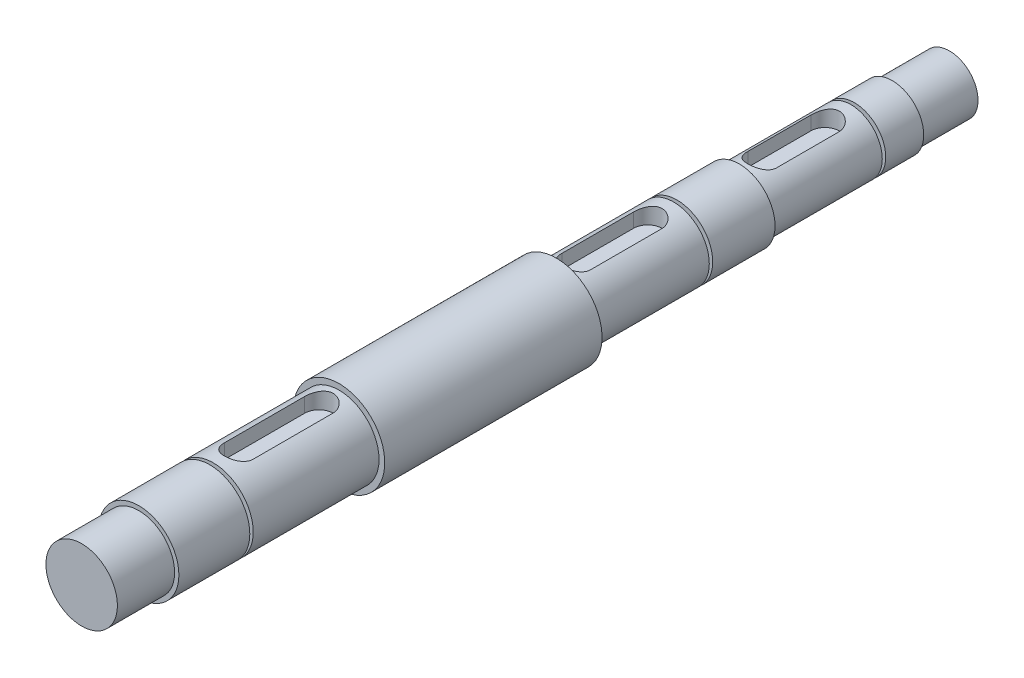
from build123d import *

# Parameters (mm, degrees)
SKETCH2_R           = 12.5
BOSS_EXTRUDE1_DEPTH = 20
SKETCH3_R           = 14
BOSS_EXTRUDE2_DEPTH = 70
SKETCH4_R           = 16
BOSS_EXTRUDE3_DEPTH = 76
BOSS_EXTRUDE4_START = 64
SKETCH5_R           = 12.5
BOSS_EXTRUDE4_DEPTH = 64
SKETCH6_R           = 11
BOSS_EXTRUDE5_DEPTH = 53.5
SKETCH7_R           = 10
BOSS_EXTRUDE6_DEPTH = 20
CUT_EXTRUDE1_DEPTH  = 6
CUT_EXTRUDE2_DEPTH  = 6
CUT_EXTRUDE3_DEPTH  = 6
SKETCH12_W          = 1.2
SKETCH12_H          = 1.8


with BuildPart() as part:
    # Sketch2 → Boss-Extrude1 (new body)
    with BuildSketch(Plane.XY):
        Circle(SKETCH2_R)
    extrude(amount=BOSS_EXTRUDE1_DEPTH)

    # Sketch3 → Boss-Extrude2 (add)
    with BuildSketch(Plane(origin=(0, 0, 0), x_dir=(-1, 0, 0), z_dir=(0, 0, -1))):
        Circle(SKETCH3_R)
    extrude(amount=BOSS_EXTRUDE2_DEPTH)

    # Sketch4 → Boss-Extrude3 (add)
    with BuildSketch(Plane(origin=(0, 0, -70), x_dir=(-1, 0, 0), z_dir=(0, 0, -1))):
        Circle(SKETCH4_R)
    extrude(amount=BOSS_EXTRUDE3_DEPTH)

    # Sketch5 → Boss-Extrude4 (add)
    with BuildSketch(Plane(origin=(0, 0, -146), x_dir=(-1, 0, 0), z_dir=(0, 0, -1)).offset(BOSS_EXTRUDE4_START)):
        with Locations(Location((0, 0, 0), (0, 0, 180))):
            Circle(SKETCH5_R)
    extrude(amount=-BOSS_EXTRUDE4_DEPTH)

    # Sketch6 → Boss-Extrude5 (add)
    with BuildSketch(Plane(origin=(0, 0, -210), x_dir=(-1, 0, 0), z_dir=(0, 0, -1))):
        Circle(SKETCH6_R)
    extrude(amount=BOSS_EXTRUDE5_DEPTH)

    # Sketch7 → Boss-Extrude6 (add)
    with BuildSketch(Plane(origin=(0, 0, -263.5), x_dir=(-1, 0, 0), z_dir=(0, 0, -1))):
        Circle(SKETCH7_R)
    extrude(amount=BOSS_EXTRUDE6_DEPTH)

    # Sketch8 → Cut-Extrude1 (cut)
    with BuildSketch(Plane(origin=(0, 14, 0), x_dir=(1, 0, 0), z_dir=(0, 1, 0))):
        with BuildLine():
            Line((5, 63), (5, 35))
            ThreePointArc((5, 35), (0, 30), (-5, 35))
            Line((-5, 35), (-5, 63))
            ThreePointArc((-5, 63), (0, 68), (5, 63))
        make_face()
    extrude(amount=-CUT_EXTRUDE1_DEPTH, mode=Mode.SUBTRACT)

    # Sketch9 → Cut-Extrude2 (cut)
    with BuildSketch(Plane(origin=(0, 12.5, 0), x_dir=(1, 0, 0), z_dir=(0, 1, 0))):
        with BuildLine():
            Line((-5, 153), (-5, 178))
            ThreePointArc((-5, 178), (0, 183), (5, 178))
            Line((5, 178), (5, 153))
            ThreePointArc((5, 153), (0, 148), (-5, 153))
        make_face()
    extrude(amount=-CUT_EXTRUDE2_DEPTH, mode=Mode.SUBTRACT)

    # Sketch11 → Cut-Extrude3 (cut)
    with BuildSketch(Plane(origin=(0, 11, 0), x_dir=(1, 0, 0), z_dir=(0, 1, 0))):
        with BuildLine():
            Line((-5, 218), (-5, 240))
            ThreePointArc((-5, 240), (0, 245), (5, 240))
            Line((5, 240), (5, 218))
            ThreePointArc((5, 218), (0, 213), (-5, 218))
        make_face()
    extrude(amount=-CUT_EXTRUDE3_DEPTH, mode=Mode.SUBTRACT)

    # Sketch12 → Cut-Revolve1 (revolve, cut)
    with BuildSketch(Plane(origin=(0, 0, 0), x_dir=(0, 0, -1), z_dir=(1, 0, 0)), mode=Mode.PRIVATE) as cut_revolve1_sk:
        with Locations((25.4, 13.1)):
            Rectangle(SKETCH12_W, SKETCH12_H)
        with Locations((187.6, 11.6)):
            Rectangle(SKETCH12_W, SKETCH12_H)
        with Locations((249.6, 10.1)):
            Rectangle(SKETCH12_W, SKETCH12_H)
    revolve(cut_revolve1_sk.sketch.rotate(Axis((0, 0, 20.679207299), (0, 0, -1)), 90), axis=Axis((0, 0, 20.679207299), (0, 0, -1)), mode=Mode.SUBTRACT)


solid = part.part
